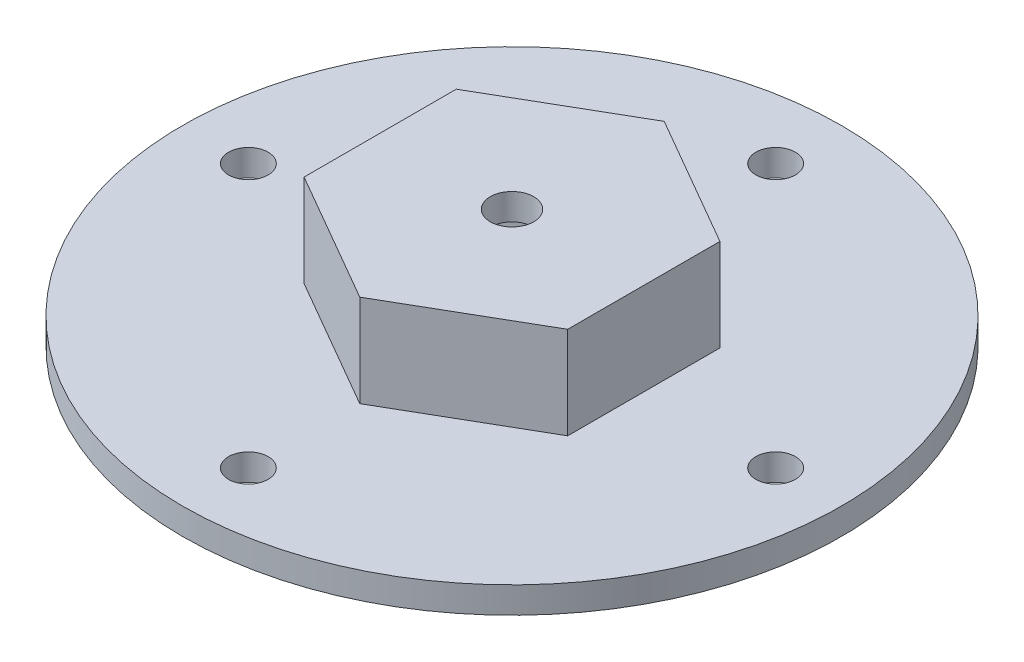
from build123d import *

# Parameters (mm, degrees)
SKETCH1_R             = 25
BOSS_EXTRUDE1_DEPTH   = 2
SKETCH2_R             = 1.5
CUT_EXTRUDE1_DEPTH    = 3
BOSS_EXTRUDE2_DEPTH   = 7
CUT_EXTRUDE2_DEPTH    = 7
M4_TAPPED_HOLE1_D     = 3.3
M4_TAPPED_HOLE1_DEPTH = 5
M4_TAPPED_HOLE2_D     = 3.3


with BuildPart() as part:
    # Sketch1 → Boss-Extrude1 (new body)
    with BuildSketch(Plane(origin=(0, 0, 0), x_dir=(1, 0, 0), z_dir=(0, 1, 0))):
        with Locations(Location((0, 0, 0), (0, 0, 270))):
            Circle(SKETCH1_R)
    extrude(amount=BOSS_EXTRUDE1_DEPTH)

    # Sketch2 → Cut-Extrude1 (cut)
    with BuildSketch(Plane(origin=(0, 2, 0), x_dir=(1, 0, 0), z_dir=(0, 1, 0))):
        with Locations(Location((0, 20, 0), (0, 0, 270))):
            Circle(SKETCH2_R)
        with Locations(Location((20, 0, 0), (0, 0, 270))):
            Circle(SKETCH2_R)
        with Locations(Location((0, -20, 0), (0, 0, 270))):
            Circle(SKETCH2_R)
        with Locations(Location((-20, 0, 0), (0, 0, 270))):
            Circle(SKETCH2_R)
    extrude(amount=-CUT_EXTRUDE1_DEPTH, mode=Mode.SUBTRACT)

    # Sketch3 → Boss-Extrude2 (add)
    with BuildSketch(Plane(origin=(0, 2, 0), x_dir=(1, 0, 0), z_dir=(0, 1, 0))):
        Polygon((0, 11.547005384), (-10, 5.773502692), (-10, -5.773502692), (0, -11.547005384), (10, -5.773502692), (10, 5.773502692), align=None)
    extrude(amount=BOSS_EXTRUDE2_DEPTH)

    # Sketch4 → Cut-Extrude2 (cut)
    with BuildSketch(Plane.XZ):
        Polygon((0, 5.773502692), (-5, 2.886751346), (-5, -2.886751346), (0, -5.773502692), (5, -2.886751346), (5, 2.886751346), align=None)
    extrude(amount=-CUT_EXTRUDE2_DEPTH, mode=Mode.SUBTRACT)

    # M4 Tapped Hole1
    with Locations(Plane.ZY.offset(10)):
        with Locations((0, 5)):
            Hole(M4_TAPPED_HOLE1_D / 2, depth=M4_TAPPED_HOLE1_DEPTH)

    # M4 Tapped Hole2 (through all)
    with Locations(Plane(origin=(0, 9, 0), x_dir=(1, 0, 0), z_dir=(0, 1, 0))):
        with Locations((0, 0)):
            Hole(M4_TAPPED_HOLE2_D / 2)


solid = part.part
